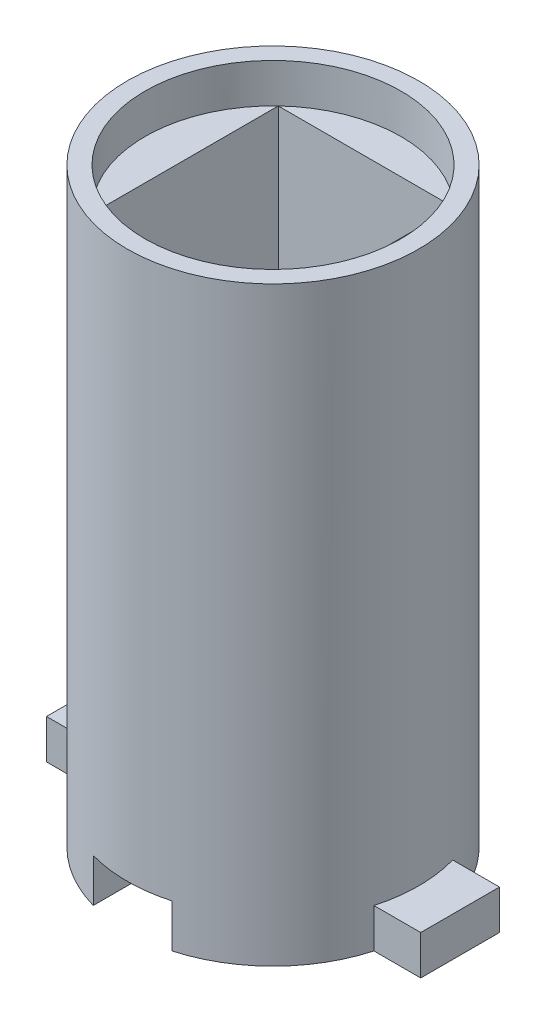
from build123d import *

# Parameters (mm, degrees)
SKETCH1_R           = 37
BOSS_EXTRUDE1_DEPTH = 150
SKETCH2_W           = 23
SKETCH2_H           = 23
CUT_EXTRUDE1_DEPTH  = 150
SKETCH3_W           = 43
SKETCH3_H           = 43
CUT_EXTRUDE2_DEPTH  = 36
CHAMFER1_SIZE       = 5
SKETCH5_R           = 32.5
CUT_EXTRUDE3_DEPTH  = 10
SKETCH11_W          = 44.607289856
SKETCH11_H          = 47.277792796
CUT_EXTRUDE7_DEPTH  = 104
SKETCH12_W          = 26
SKETCH12_H          = 20
BOSS_EXTRUDE2_DEPTH = 10
SKETCH13_W          = 20
SKETCH13_H          = 31
CUT_EXTRUDE8_DEPTH  = 11


with BuildPart() as part:
    # Sketch1 → Boss-Extrude1 (new body)
    with BuildSketch(Plane(origin=(0, 0, 0), x_dir=(1, 0, 0), z_dir=(0, 1, 0))):
        with Locations(Location((0, 0, 0), (0, 0, 270))):
            Circle(SKETCH1_R)
    extrude(amount=BOSS_EXTRUDE1_DEPTH)

    # Sketch2 → Cut-Extrude1 (cut)
    with BuildSketch(Plane(origin=(0, 150, 0), x_dir=(1, 0, 0), z_dir=(0, 1, 0))):
        Rectangle(SKETCH2_W, SKETCH2_H)
    extrude(amount=-CUT_EXTRUDE1_DEPTH, mode=Mode.SUBTRACT)

    # Sketch3 → Cut-Extrude2 (cut)
    with BuildSketch(Plane.XZ):
        Rectangle(SKETCH3_W, SKETCH3_H)
    extrude(amount=-CUT_EXTRUDE2_DEPTH, mode=Mode.SUBTRACT)

    # Chamfer1
    chamfer1_edges = [part.edges().sort_by_distance(p)[0] for p in [
        (21.5, 18, 21.5),
        (21.5, 18, -21.5),
        (-21.5, 18, -21.5),
        (-21.5, 18, 21.5),
    ]]
    chamfer(chamfer1_edges, length=CHAMFER1_SIZE)

    # Sketch5 → Cut-Extrude3 (cut)
    with BuildSketch(Plane(origin=(0, 150, 0), x_dir=(1, 0, 0), z_dir=(0, 1, 0))):
        with Locations(Location((0, 0, 0), (0, 0, 270))):
            Circle(SKETCH5_R)
    extrude(amount=-CUT_EXTRUDE3_DEPTH, mode=Mode.SUBTRACT)

    # Sketch11 → Cut-Extrude7 (cut)
    with BuildSketch(Plane(origin=(0, 140, 0), x_dir=(1, 0, 0), z_dir=(0, 1, 0))):
        Rectangle(SKETCH11_W, SKETCH11_H)
    extrude(amount=-CUT_EXTRUDE7_DEPTH, mode=Mode.SUBTRACT)

    # Sketch12 → Boss-Extrude2 (add)
    with BuildSketch(Plane.XZ):
        with Locations((-34.5, 0)):
            Rectangle(SKETCH12_W, SKETCH12_H)
        with Locations((34.5, 0)):
            Rectangle(SKETCH12_W, SKETCH12_H)
    extrude(amount=-BOSS_EXTRUDE2_DEPTH)

    # Sketch13 → Cut-Extrude8 (cut)
    with BuildSketch(Plane.XZ):
        with Locations((0, 37)):
            Rectangle(SKETCH13_W, SKETCH13_H)
    extrude(amount=-CUT_EXTRUDE8_DEPTH, mode=Mode.SUBTRACT)


solid = part.part
